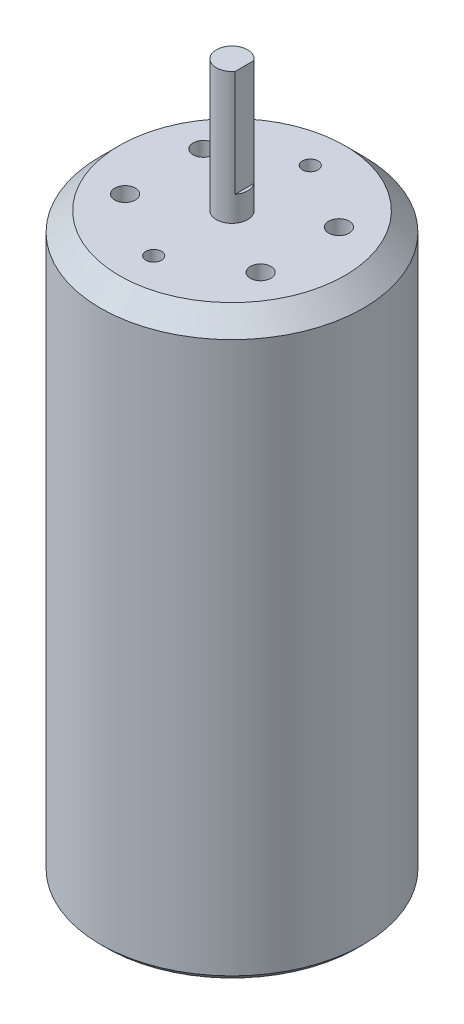
from build123d import *

# Parameters (mm, degrees)
CUT_EXTRUDE1_START              = -17
CUT_EXTRUDE1_DEPTH              = 17
TAP_DRILL_FOR_M3X0_5_TAP1_D     = 2.5
TAP_DRILL_FOR_M3X0_5_TAP1_DEPTH = 9.248924226
TAP_DRILL_FOR_M3X0_5_TAP1_TIP   = 0.751075774
TAP_DRILL_FOR_M4X0_7_TAP1_D     = 3.3
TAP_DRILL_FOR_M4X0_7_TAP1_DEPTH = 9.008579979
TAP_DRILL_FOR_M4X0_7_TAP1_TIP   = 0.991420021
CHAMFER1_SIZE                   = 3
CHAMFER2_SIZE                   = 1


with BuildPart() as part:
    # Sketch1 → Revolve1 (revolve)
    with BuildSketch(Plane.XY, mode=Mode.PRIVATE) as revolve1_sk:
        Polygon((0, 0), (0, 113), (2.5, 113), (2.5, 92), (21, 92), (21, 0), align=None)
    revolve(revolve1_sk.sketch.rotate(Axis((0, 0, 0), (0, 1, 0)), 90), axis=Axis((0, 0, 0), (0, 1, 0)))

    # Sketch2 → Cut-Extrude1 (cut)
    with BuildSketch(Plane(origin=(0, 113, 0), x_dir=(1, 0, 0), z_dir=(0, 1, 0)).offset(CUT_EXTRUDE1_START)):
        with BuildLine():
            Line((2, -1.5), (2, 1.5))
            ThreePointArc((2, 1.5), (2.5, 0), (2, -1.5))
        make_face()
    extrude(amount=CUT_EXTRUDE1_DEPTH, mode=Mode.SUBTRACT)

    # Tap Drill for M3x0.5 Tap1
    with Locations(Plane(origin=(0, 92, 0), x_dir=(1, 0, 0), z_dir=(0, 1, 0))):
        with Locations((0, 12.5), (0, -12.5)):
            Hole(TAP_DRILL_FOR_M3X0_5_TAP1_D / 2, depth=TAP_DRILL_FOR_M3X0_5_TAP1_DEPTH)
            with Locations((0, 0, -(TAP_DRILL_FOR_M3X0_5_TAP1_DEPTH + TAP_DRILL_FOR_M3X0_5_TAP1_TIP / 2))):  # 118° drill point
                Cone(0, TAP_DRILL_FOR_M3X0_5_TAP1_D / 2, TAP_DRILL_FOR_M3X0_5_TAP1_TIP, mode=Mode.SUBTRACT)

    # Tap Drill for M4x0.7 Tap1
    with Locations(Plane(origin=(0, 92, 0), x_dir=(1, 0, 0), z_dir=(0, 1, 0))):
        with Locations((-10.825317547, 6.25), (-10.825317547, -6.25), (10.825317547, -6.25), (10.825317547, 6.25)):
            Hole(TAP_DRILL_FOR_M4X0_7_TAP1_D / 2, depth=TAP_DRILL_FOR_M4X0_7_TAP1_DEPTH)
            with Locations((0, 0, -(TAP_DRILL_FOR_M4X0_7_TAP1_DEPTH + TAP_DRILL_FOR_M4X0_7_TAP1_TIP / 2))):  # 118° drill point
                Cone(0, TAP_DRILL_FOR_M4X0_7_TAP1_D / 2, TAP_DRILL_FOR_M4X0_7_TAP1_TIP, mode=Mode.SUBTRACT)

    # Chamfer1
    chamfer1_edges = [part.edges().sort_by_distance(p)[0] for p in [
        (0, 92, 21),
    ]]
    chamfer(chamfer1_edges, length=CHAMFER1_SIZE)

    # Chamfer2
    chamfer2_edges = [part.edges().sort_by_distance(p)[0] for p in [
        (0, 0, 21),
    ]]
    chamfer(chamfer2_edges, length=CHAMFER2_SIZE)


solid = part.part
